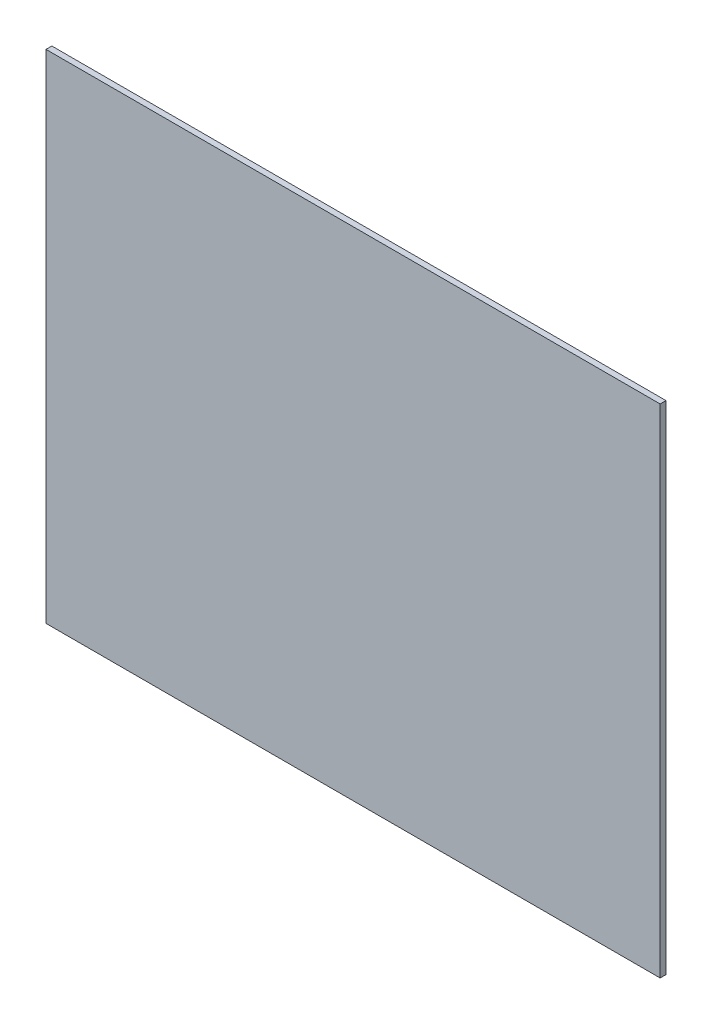
from build123d import *

# Parameters (mm, degrees)
SKETCH1_W           = 210
SKETCH1_H           = 170
BOSS_EXTRUDE1_DEPTH = 2


with BuildPart() as part:
    # Sketch1 → Boss-Extrude1 (new body)
    with BuildSketch(Plane.XY):
        Rectangle(SKETCH1_W, SKETCH1_H)
    extrude(amount=BOSS_EXTRUDE1_DEPTH)


solid = part.part
